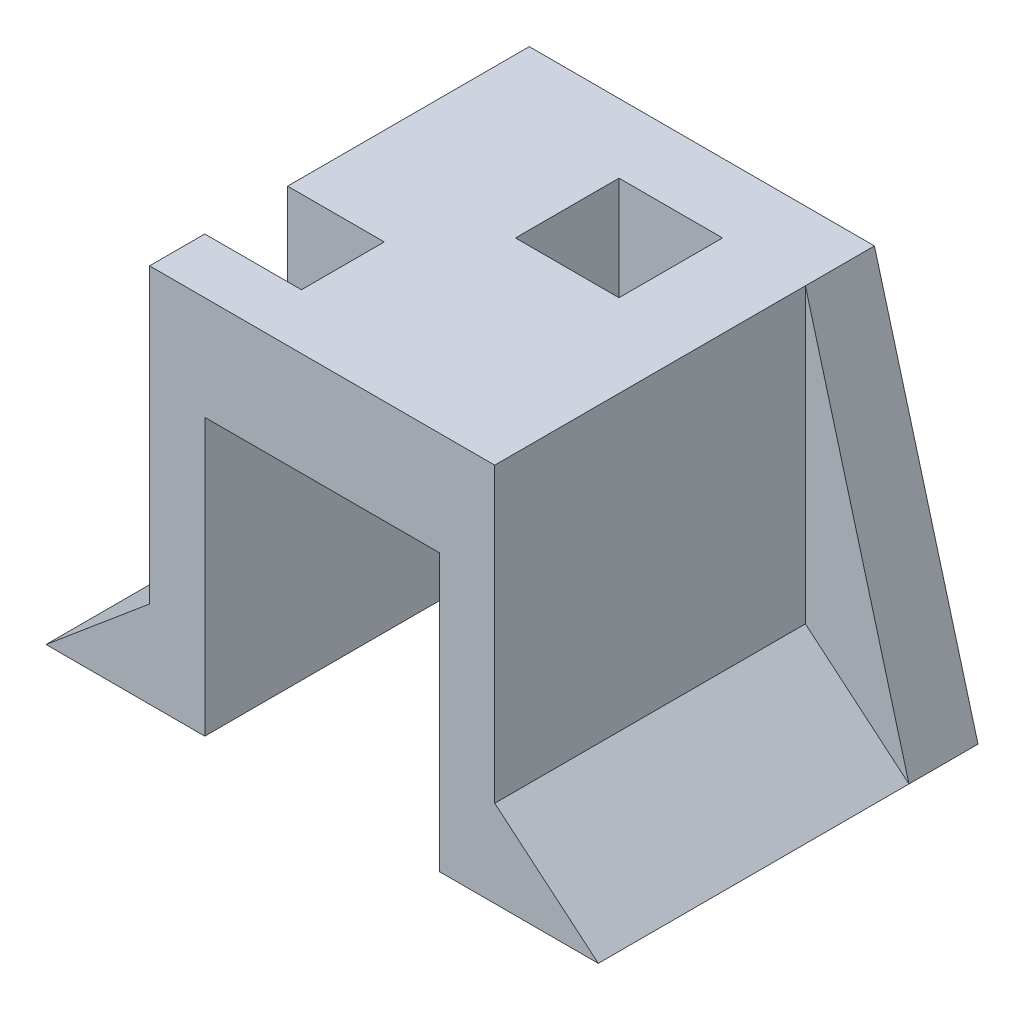
from build123d import *

# Parameters (mm, degrees)
EXTRUDE_1_DEPTH     = 55
EXTRUDE_2_DEPTH     = 10
SKETCH_3_W          = 15
SKETCH_3_H          = 15
CUT_EXTRUDE_1_DEPTH = 99.234413522
CUT_EXTRUDE_START   = -8
CUT_EXTRUDE_2_DEPTH = 12


with BuildPart() as part:
    # Эскиз1 → Бобышка-Вытянуть1 (new body)
    with BuildSketch(Plane.XY):
        Polygon((-20, 27.5), (-20, 12.5), (-3, 12.5), (-3, -27.5), (20, -27.5), (5, -14.913505532), (5, 27.5), align=None)
    extrude_1 = extrude(amount=EXTRUDE_1_DEPTH)

    # Эскиз2 → Бобышка-Вытянуть2 (add)
    with BuildSketch(Plane(origin=(0, 0, 0), x_dir=(-1, 0, 0), z_dir=(0, 0, -1))):
        Polygon((-5, 27.5), (-20, -27.5), (-5, -14.913505532), align=None)
    extrude_2 = extrude(amount=-EXTRUDE_2_DEPTH)

    # Зеркальное отражение1: Бобышка-Вытянуть1, Бобышка-Вытянуть2 across plane
    add(extrude_1.mirror(Plane(origin=(-20, 0, 55), x_dir=(0, 0, 1), z_dir=(-1, 0, 0))))
    add(extrude_2.mirror(Plane(origin=(-20, 0, 55), x_dir=(0, 0, 1), z_dir=(-1, 0, 0))))

    # Эскиз3 → Вырез-Вытянуть1 (cut, through all)
    with BuildSketch(Plane(origin=(0, 27.5, 0), x_dir=(1, 0, 0), z_dir=(0, 1, 0))):
        with Locations((-14.5, -17.5)):
            Rectangle(SKETCH_3_W, SKETCH_3_H)
    extrude(amount=-CUT_EXTRUDE_1_DEPTH, mode=Mode.SUBTRACT)

    # Эскиз4 → Вырез-Вытянуть2 (cut)
    with BuildSketch(Plane.XY.offset(55).offset(CUT_EXTRUDE_START)):
        Polygon((-45, 27.5), (-45, 13.5), (-31, 27.5), align=None)
    extrude(amount=-CUT_EXTRUDE_2_DEPTH, mode=Mode.SUBTRACT)


solid = part.part
